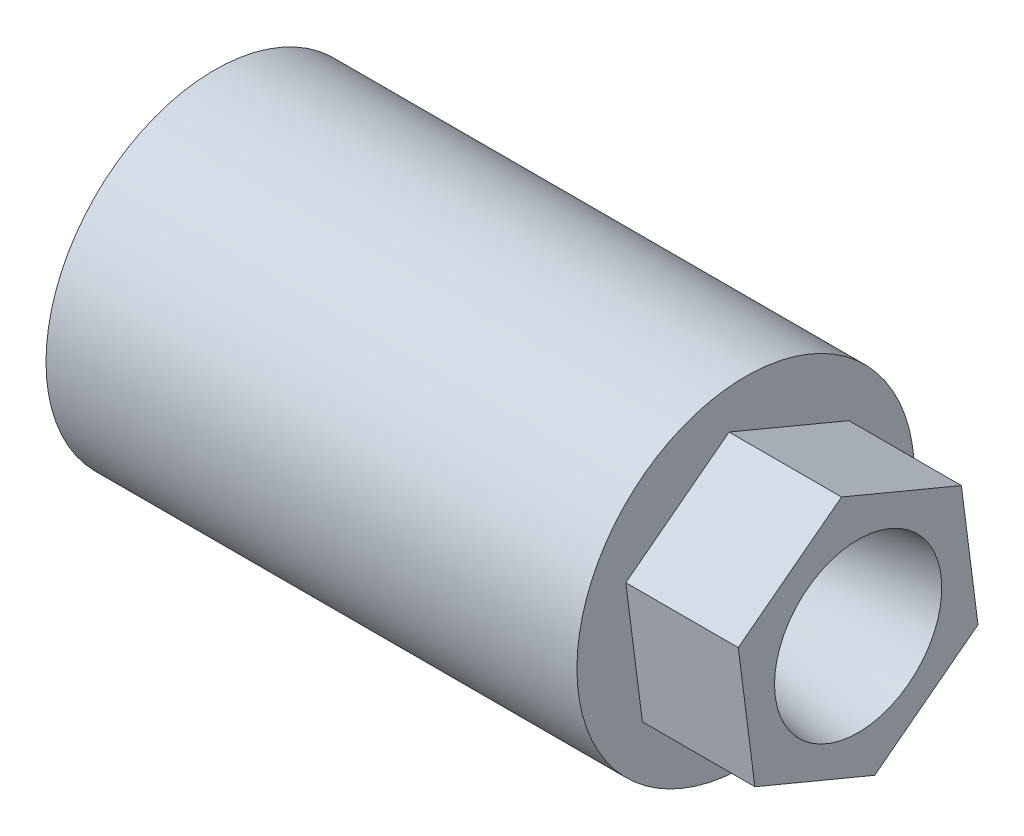
from build123d import *

# Parameters (mm, degrees)
SKETCH3_R          = 9.525
CUT_EXTRUDE2_DEPTH = 6.35


with BuildPart() as part:
    # Sketch1 → Revolve1 (revolve)
    with BuildSketch(Plane.XY, mode=Mode.PRIVATE) as revolve1_sk:
        with BuildLine():
            Line((-2.155261469, 2.924738531), (-4.047950886, 4.817427948))
            ThreePointArc((-4.047950886, 4.817427948), (-5.077995018, 5.505681433), (-6.293014916, 5.747363917))
            Line((-6.293014916, 5.747363917), (-25.4, 5.747363917))
            Line((-25.4, 5.747363917), (-25.4, 9.525))
            Line((-25.4, 9.525), (-1.777203317, 9.525))
            Line((-1.777203317, 9.525), (10.922796683, 9.525))
            Line((10.922796683, 9.525), (10.922796683, 4.721941296))
            add(Edge.make_bspline(
                [(10.922796683, 4.721941296), (5.402180861, 3.94606934), (0.277993972, 2.081017838)],
                knots=[0, 0, 0, 1, 1, 1], degree=2))
            ThreePointArc((0.277993972, 2.081017838), (0.141141239, 2.044348258), (0, 2.032))
            ThreePointArc((0, 2.032), (-1.166419102, 2.264015185), (-2.155261469, 2.924738531))
        make_face()
    revolve(revolve1_sk.sketch.rotate(Axis((0, 0, 0), (1, 0, 0)), 90), axis=Axis((0, 0, 0), (1, 0, 0)))

    # Sketch3 → Cut-Extrude2 (cut)
    with BuildSketch(Plane(origin=(10.922796683, 0, 0), x_dir=(0, 0, -1), z_dir=(1, 0, 0))):
        with Locations(Location((0, 0, 0), (0, 0, 180))):
            Circle(SKETCH3_R)
        Polygon((-5.829170486, -4.447932641), (0.937437419, -7.272176044), (6.766607905, -2.824243403), (5.829170486, 4.447932641), (-0.937437419, 7.272176044), (-6.766607905, 2.824243403), align=None, mode=Mode.SUBTRACT)
    extrude(amount=-CUT_EXTRUDE2_DEPTH, mode=Mode.SUBTRACT)


solid = part.part
